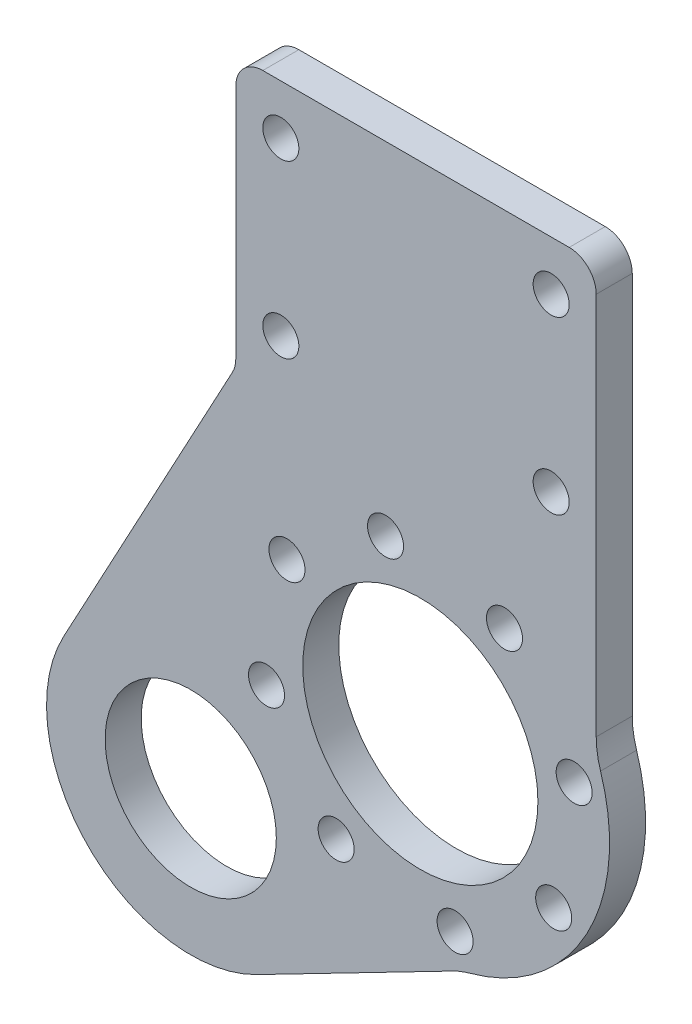
from build123d import *

# Parameters (mm, degrees)
SKETCH_1_R          = 13.05
SKETCH_1_R_2        = 9.5
EXTRUDE_1_DEPTH     = 4
FILLET_1_R          = 3
CUT_EXTRUDE_START   = -10
CUT_EXTRUDE_1_DEPTH = 10
SKETCH_3_R          = 2
CUT_EXTRUDE_2_DEPTH = 10
FILLET_2_R          = 3
SKETCH_4_R          = 2
CUT_EXTRUDE_3_DEPTH = 28
SKETCH_6_R          = 20.45
EXTRUDE_2_DEPTH     = 4
SKETCH_7_R          = 21
EXTRUDE_3_DEPTH     = 4
SKETCH_8_R          = 13.05
CUT_EXTRUDE_4_DEPTH = 4
SKETCH_9_R          = 2
CUT_EXTRUDE_5_DEPTH = 4
FILLET_3_R          = 10


with BuildPart() as part:
    # 草图1 → 凸台-拉伸1 (new body)
    with BuildSketch(Plane.XY):
        with BuildLine():
            Line((-16, 73), (-16, 0))
            ThreePointArc((-16, 0), (-8.327115073, -13.662326103), (7.33239432, -14.220970204))
            Line((7.33239432, -14.220970204), (33.623767545, -0.665023393))
            ThreePointArc((33.623767545, -0.665023393), (41.931803011, 7.070661466), (45, 18))
            Line((45, 18), (45, 73))
            Line((45, 73), (-16, 73))
        make_face()
        with Locations((24, 18)):
            Circle(SKETCH_1_R, mode=Mode.SUBTRACT)
        Circle(SKETCH_1_R_2, mode=Mode.SUBTRACT)
    extrude(amount=EXTRUDE_1_DEPTH)

    # 圆角1
    fillet_1_edges = [part.edges().sort_by_distance(p)[0] for p in [
        (45, 73, 2),
        (-16, 73, 2),
    ]]
    fillet(fillet_1_edges, radius=FILLET_1_R)

    # 草图2 → 切除-拉伸1 (cut)
    with BuildSketch(Plane.XY.offset(4).offset(CUT_EXTRUDE_START)):
        with BuildLine():
            Line((-14.084507501, 7.591221802), (5, 43))
            Line((5, 43), (5, 73))
            Line((5, 73), (-16, 73))
            Line((-16, 73), (-16, 0))
            ThreePointArc((-16, 0), (-15.513737783, 3.914580436), (-14.084507501, 7.591221802))
        make_face()
    extrude(amount=CUT_EXTRUDE_1_DEPTH, mode=Mode.SUBTRACT)

    # 草图3 → 切除-拉伸2 (cut)
    with BuildSketch(Plane.XY.offset(4)):
        with Locations((8.941696856, 26.916137415)):
            Circle(SKETCH_3_R)
        with Locations((19.656832962, 34.952489495)):
            Circle(SKETCH_3_R)
        with Locations((32.916137415, 33.058303144)):
            Circle(SKETCH_3_R)
        with Locations((40.952489495, 22.343167038)):
            Circle(SKETCH_3_R)
        with Locations((39.058303144, 9.083862585)):
            Circle(SKETCH_3_R)
        with Locations((28.343167038, 1.047510505)):
            Circle(SKETCH_3_R)
        with Locations((15.083862585, 2.941696856)):
            Circle(SKETCH_3_R)
        with Locations((7.047510505, 13.656832962)):
            Circle(SKETCH_3_R)
    extrude(amount=-CUT_EXTRUDE_2_DEPTH, mode=Mode.SUBTRACT)

    # 圆角2
    fillet_2_edges = [part.edges().sort_by_distance(p)[0] for p in [
        (5, 43, 2),
        (5, 73, 2),
    ]]
    fillet(fillet_2_edges, radius=FILLET_2_R)

    # 草图4 → 切除-拉伸3 (cut)
    with BuildSketch(Plane.XY.offset(4)):
        with Locations((40, 67.5)):
            Circle(SKETCH_4_R)
        with Locations((10, 67.5)):
            Circle(SKETCH_4_R)
        with Locations((10, 48.5)):
            Circle(SKETCH_4_R)
        with Locations((40, 48.5)):
            Circle(SKETCH_4_R)
    extrude(amount=-CUT_EXTRUDE_3_DEPTH, mode=Mode.SUBTRACT)

    # 草图6 → 凸台-拉伸2 (add)
    with BuildSketch(Plane.XY.offset(4)):
        with Locations((24, 18)):
            Circle(SKETCH_6_R)
    extrude(amount=-EXTRUDE_2_DEPTH)

    # 草图7 → 凸台-拉伸3 (add)
    with BuildSketch(Plane.XY.offset(4)):
        with Locations((25.48, 18)):
            Circle(SKETCH_7_R)
    extrude(amount=-EXTRUDE_3_DEPTH)

    # 草图8 → 切除-拉伸4 (cut)
    with BuildSketch(Plane.XY.offset(4)):
        with Locations((25.48, 18)):
            Circle(SKETCH_8_R)
    extrude(amount=-CUT_EXTRUDE_4_DEPTH, mode=Mode.SUBTRACT)

    # 草图9 → 切除-拉伸5 (cut)
    with BuildSketch(Plane.XY.offset(4)):
        with Locations((10.681592776, 27.341153229)):
            Circle(SKETCH_9_R)
        with Locations((21.621138693, 35.069246891)):
            Circle(SKETCH_9_R)
        with Locations((34.821153229, 32.798407224)):
            Circle(SKETCH_9_R)
        with Locations((42.549246891, 21.858861307)):
            Circle(SKETCH_9_R)
        with Locations((40.278407224, 8.658846771)):
            Circle(SKETCH_9_R)
        with Locations((29.338861307, 0.930753109)):
            Circle(SKETCH_9_R)
        with Locations((16.138846771, 3.201592776)):
            Circle(SKETCH_9_R)
        with Locations((8.410753109, 14.141138693)):
            Circle(SKETCH_9_R)
    extrude(amount=-CUT_EXTRUDE_5_DEPTH, mode=Mode.SUBTRACT)

    # 圆角3
    fillet_3_edges = [part.edges().sort_by_distance(p)[0] for p in [
        (45, 25.744004132, 2),
        (30.087589458, -2.488292252, 2),
    ]]
    fillet(fillet_3_edges, radius=FILLET_3_R)


solid = part.part
